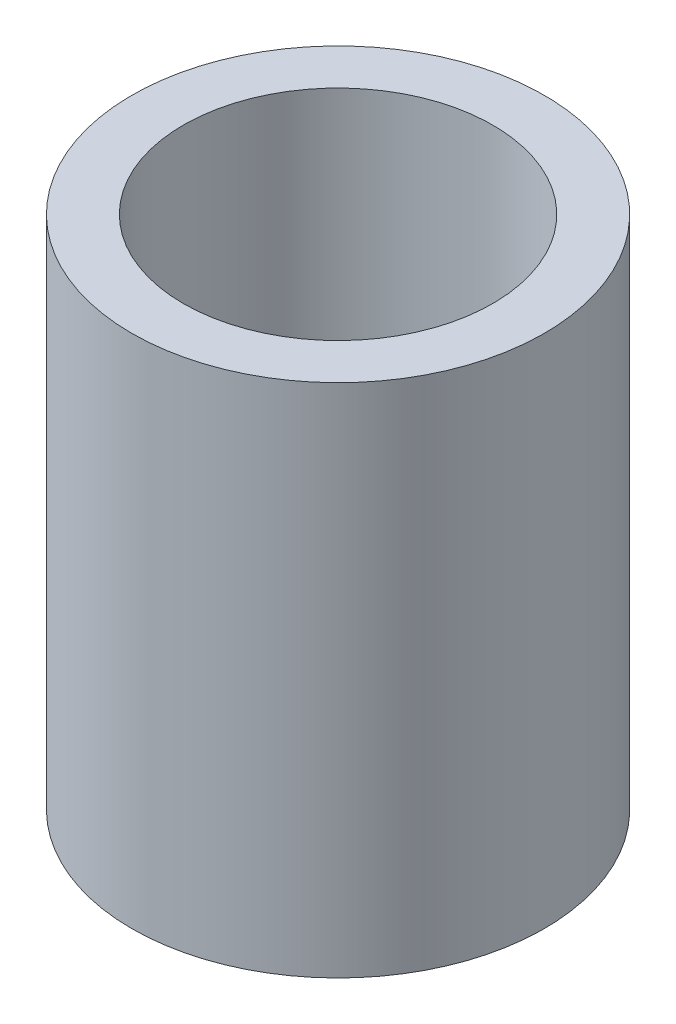
from build123d import *

# Parameters (mm, degrees)
SKETCH1_R           = 20.32
SKETCH1_R_2         = 15.24
BOSS_EXTRUDE1_DEPTH = 50.8


with BuildPart() as part:
    # Sketch1 → Boss-Extrude1 (new body)
    with BuildSketch(Plane(origin=(0, 0, 0), x_dir=(1, 0, 0), z_dir=(0, 1, 0))):
        with Locations(Location((0, 0, 0), (0, 0, 270))):
            Circle(SKETCH1_R)
        with Locations(Location((0, 0, 0), (0, 0, 270))):
            Circle(SKETCH1_R_2, mode=Mode.SUBTRACT)
    extrude(amount=BOSS_EXTRUDE1_DEPTH)


solid = part.part
